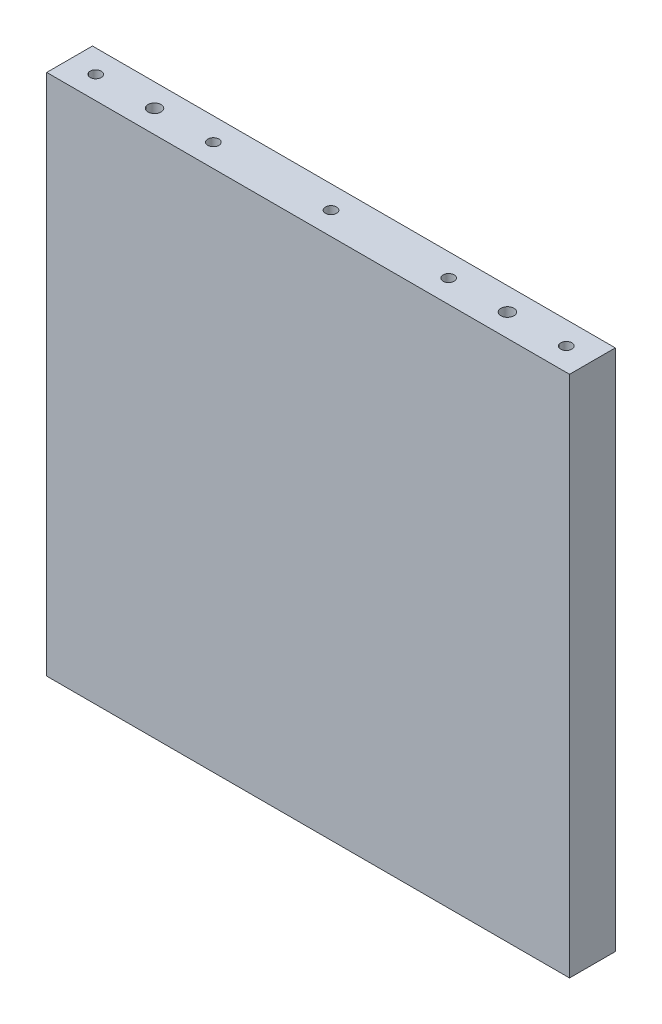
from build123d import *

# Parameters (mm, degrees)
ESBO_O1_W                    = 400
ESBO_O1_H                    = 400
RESSALTO_EXTRUS_O1_DEPTH     = 35
FURO_ROSCADO_DE_M103_D       = 8.5
FURO_ROSCADO_DE_M103_DEPTH   = 27.5
FURO_ROSCADO_DE_M103_TIP     = 2.553657631
FURO_ROSCADO_DE_M104_D       = 8.5
FURO_ROSCADO_DE_M104_DEPTH   = 27.5
FURO_ROSCADO_DE_M104_TIP     = 2.553657631
FUROS_GUIA_COM_10_0MM3_D     = 10
FUROS_GUIA_COM_10_0MM3_DEPTH = 27.5
FUROS_GUIA_COM_10_0MM3_TIP   = 3.004303095
FUROS_GUIA_COM_10_0MM4_D     = 10
FUROS_GUIA_COM_10_0MM4_DEPTH = 27.5
FUROS_GUIA_COM_10_0MM4_TIP   = 3.004303095


with BuildPart() as part:
    # Esboço1 → Ressalto-extrusão1 (new body)
    with BuildSketch(Plane.XY):
        Rectangle(ESBO_O1_W, ESBO_O1_H)
    extrude(amount=RESSALTO_EXTRUS_O1_DEPTH)

    # Furo roscado de M103
    with Locations(Plane(origin=(0, 200, 0), x_dir=(1, 0, 0), z_dir=(0, 1, 0))):
        with Locations((-180, -17.5), (-90, -17.5), (0, -17.5), (90, -17.5), (180, -17.5)):
            Hole(FURO_ROSCADO_DE_M103_D / 2, depth=FURO_ROSCADO_DE_M103_DEPTH)
            with Locations((0, 0, -(FURO_ROSCADO_DE_M103_DEPTH + FURO_ROSCADO_DE_M103_TIP / 2))):  # 118° drill point
                Cone(0, FURO_ROSCADO_DE_M103_D / 2, FURO_ROSCADO_DE_M103_TIP, mode=Mode.SUBTRACT)

    # Furo roscado de M104
    with Locations(Plane(origin=(0, -200, 0), x_dir=(-1, 0, 0), z_dir=(0, -1, 0))):
        with Locations((180, -17.5), (90, -17.5), (0, -17.5), (-90, -17.5), (-180, -17.5)):
            Hole(FURO_ROSCADO_DE_M104_D / 2, depth=FURO_ROSCADO_DE_M104_DEPTH)
            with Locations((0, 0, -(FURO_ROSCADO_DE_M104_DEPTH + FURO_ROSCADO_DE_M104_TIP / 2))):  # 118° drill point
                Cone(0, FURO_ROSCADO_DE_M104_D / 2, FURO_ROSCADO_DE_M104_TIP, mode=Mode.SUBTRACT)

    # Furos-guia com Ø10.0mm3
    with Locations(Plane(origin=(0, -200, 0), x_dir=(-1, 0, 0), z_dir=(0, -1, 0))):
        with Locations((135, -17.5), (-135, -17.5)):
            Hole(FUROS_GUIA_COM_10_0MM3_D / 2, depth=FUROS_GUIA_COM_10_0MM3_DEPTH)
            with Locations((0, 0, -(FUROS_GUIA_COM_10_0MM3_DEPTH + FUROS_GUIA_COM_10_0MM3_TIP / 2))):  # 118° drill point
                Cone(0, FUROS_GUIA_COM_10_0MM3_D / 2, FUROS_GUIA_COM_10_0MM3_TIP, mode=Mode.SUBTRACT)

    # Furos-guia com Ø10.0mm4
    with Locations(Plane(origin=(0, 200, 0), x_dir=(1, 0, 0), z_dir=(0, 1, 0))):
        with Locations((-135, -17.5), (135, -17.5)):
            Hole(FUROS_GUIA_COM_10_0MM4_D / 2, depth=FUROS_GUIA_COM_10_0MM4_DEPTH)
            with Locations((0, 0, -(FUROS_GUIA_COM_10_0MM4_DEPTH + FUROS_GUIA_COM_10_0MM4_TIP / 2))):  # 118° drill point
                Cone(0, FUROS_GUIA_COM_10_0MM4_D / 2, FUROS_GUIA_COM_10_0MM4_TIP, mode=Mode.SUBTRACT)


solid = part.part
